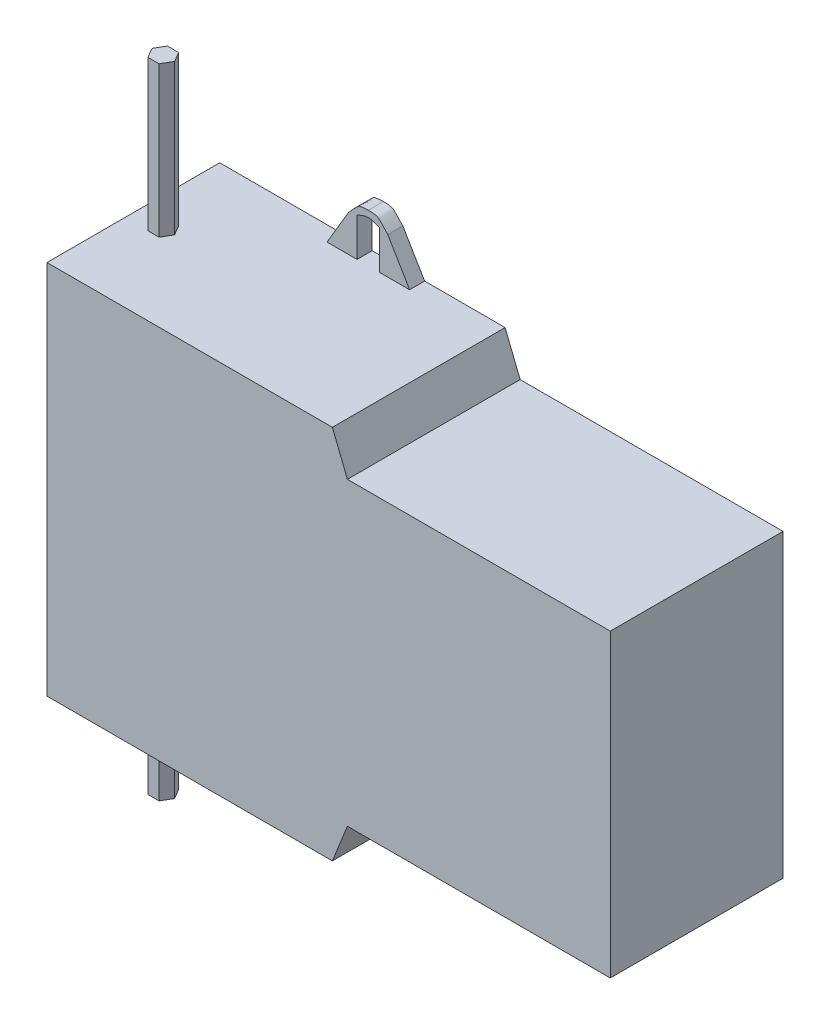
from build123d import *

# Parameters (mm, degrees)
BOSS_EXTRUDE1_DEPTH      = 23
BOSS_EXTRUDE2_DEPTH      = 2
BOSS_EXTRUDE3_DEPTH      = 15
BOSS_EXTRUDE3_DEPTH_BACK = 70


with BuildPart() as part:
    # Sketch1 → Boss-Extrude1 (new body)
    with BuildSketch(Plane.XY):
        Polygon((38, 50), (40, 45), (75, 45), (75, 5), (40, 5), (38, 0), (0, 0), (0, 50), align=None)
    extrude(amount=BOSS_EXTRUDE1_DEPTH)

    # Sketch2 → Boss-Extrude2 (add)
    with BuildSketch(Plane(origin=(0, 0, 0), x_dir=(-1, 0, 0), z_dir=(0, 0, -1))):
        with BuildLine():
            Line((-24.376413311, 54.915521171), (-27.283060583, 50))
            Line((-27.283060583, 50), (-23.283060583, 50))
            Line((-23.283060583, 50), (-23.283060583, 55.116465729))
            add(Edge.make_bspline(
                [(-23.283060583, 55.116465729), (-22.783060583, 55.344163988), (-21.783060583, 55.799560505), (-20.783060583, 55.344163988), (-20.283060583, 55.116465729)],
                knots=[0, 0, 0, 0, 0.5, 1, 1, 1, 1], degree=3))
            Line((-20.283060583, 55.116465729), (-20.283060583, 50))
            Line((-20.283060583, 50), (-16.283060583, 50))
            Line((-16.283060583, 50), (-19.189707855, 54.915521171))
            add(Edge.make_bspline(
                [(-19.189707855, 54.915521171), (-19.646594621, 55.426566158), (-20.482340041, 56.318719988), (-20.795963928, 56.329848385), (-21.430200541, 56.439930134), (-21.783060583, 56.416877275)],
                knots=[0, 0, 0, 0, 0.318153244, 0.553620623, 0.81642651, 0.81642651, 0.81642651, 0.81642651], degree=3))
            add(Edge.make_bspline(
                [(-24.376413311, 54.915521171), (-23.919526545, 55.426566158), (-23.083781124, 56.318719988), (-22.770157237, 56.329848385), (-22.135920624, 56.439930134), (-21.783060583, 56.416877275)],
                knots=[0, 0, 0, 0, 0.318153244, 0.553620623, 0.81642651, 0.81642651, 0.81642651, 0.81642651], degree=3))
        make_face()
    boss_extrude2 = extrude(amount=-BOSS_EXTRUDE2_DEPTH)

    # Mirror1: Boss-Extrude2 across plane
    add(boss_extrude2.mirror(Plane.ZX.offset(25)))

    # Sketch3 → Boss-Extrude3 (add, two sides: drawn at the far end of the back side and taken through both)
    with BuildSketch(Plane.XZ.offset(-BOSS_EXTRUDE3_DEPTH_BACK)):
        Polygon((5.3022214, 11.32), (4.55166605, 12.62), (3.05055535, 12.62), (2.3, 11.32), (3.05055535, 10.02), (4.55166605, 10.02), align=None)
    extrude(amount=BOSS_EXTRUDE3_DEPTH + BOSS_EXTRUDE3_DEPTH_BACK)


solid = part.part
